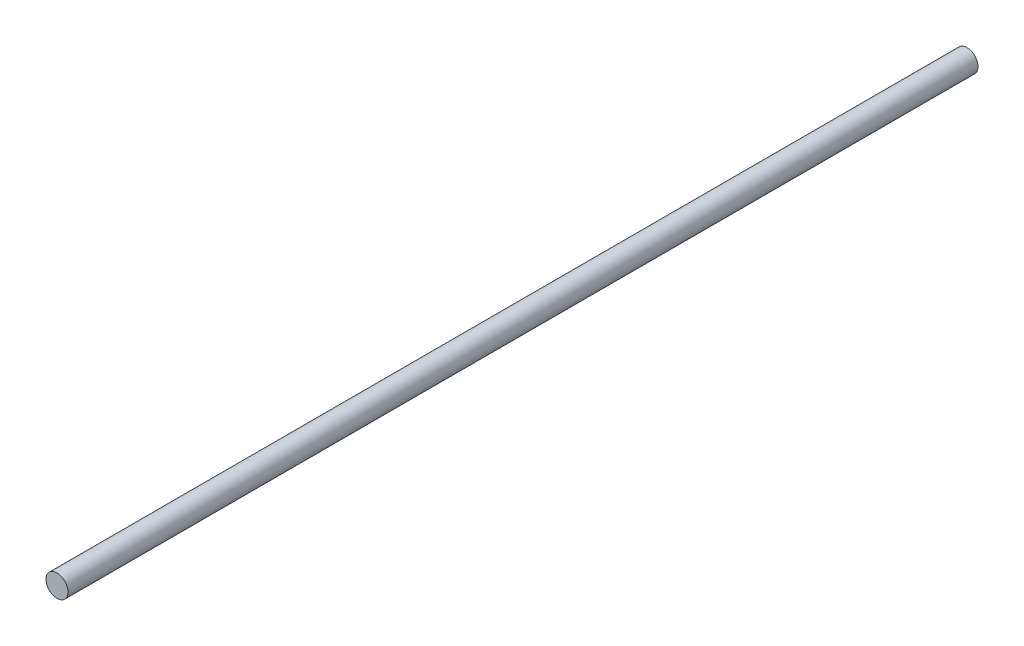
from build123d import *

# Parameters (mm, degrees)
SKETCH1_R           = 4
BOSS_EXTRUDE1_DEPTH = 330


with BuildPart() as part:
    # Sketch1 → Boss-Extrude1 (new body)
    with BuildSketch(Plane.XY):
        with Locations((-5.987136889, 4.964489284)):
            Circle(SKETCH1_R)
    extrude(amount=BOSS_EXTRUDE1_DEPTH)


solid = part.part
